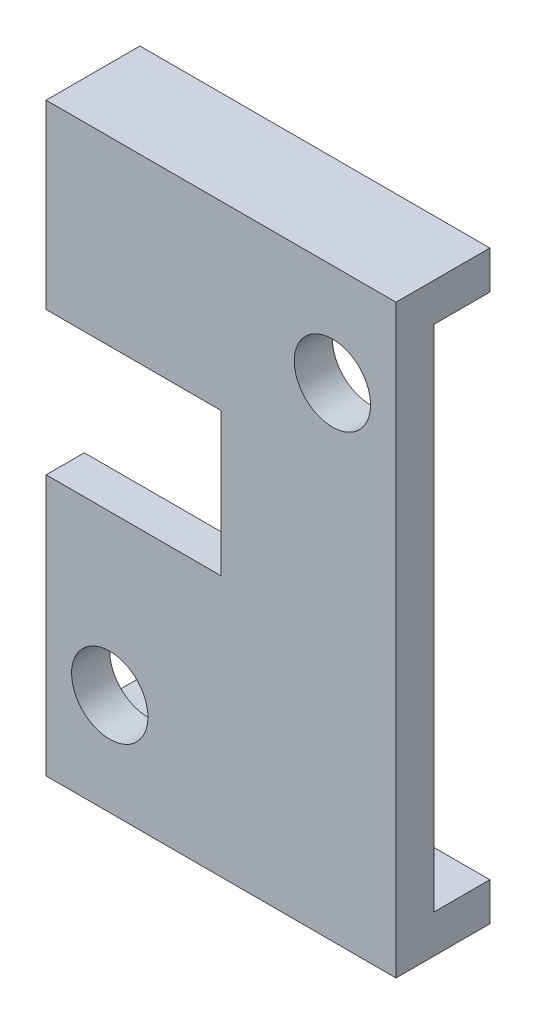
from build123d import *

# Parameters (mm, degrees)
BOSS_EXTRUDE1_DEPTH = 11
SKETCH3_R           = 1.2
SKETCH3_W           = 5.5
SKETCH3_H           = 4.5
CUT_EXTRUDE1_DEPTH  = 22.508661046


with BuildPart() as part:
    # Sketch1 → Boss-Extrude1 (new body)
    with BuildSketch(Plane(origin=(0, 0, 0), x_dir=(0, 0, -1), z_dir=(1, 0, 0))):
        Polygon((0, 0), (-2.95, 0), (-2.95, 18.4), (0, 18.4), (0, 17.2), (-1.75, 17.2), (-1.75, 1.2), (0, 1.2), align=None)
    extrude(amount=BOSS_EXTRUDE1_DEPTH)

    # Sketch3 → Cut-Extrude1 (cut, through all)
    with BuildSketch(Plane(origin=(0, 0, 1.75), x_dir=(-1, 0, 0), z_dir=(0, 0, -1))):
        with Locations(Location((-9, 15.2, 0), (0, 0, 90))):
            Circle(SKETCH3_R)
        with Locations(Location((-2, 3.2, 0), (0, 0, 90))):
            Circle(SKETCH3_R)
        with Locations((-2.75, 10.45)):
            Rectangle(SKETCH3_W, SKETCH3_H)
    extrude(amount=-CUT_EXTRUDE1_DEPTH, mode=Mode.SUBTRACT)


solid = part.part
